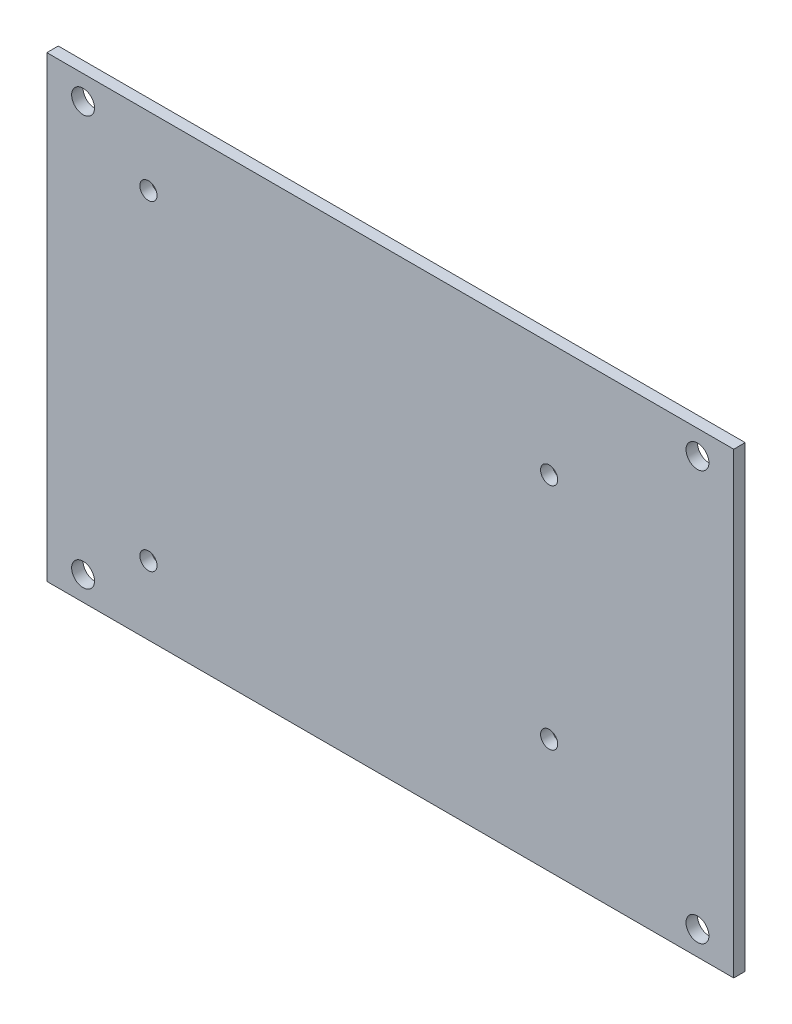
from build123d import *

# Parameters (mm, degrees)
SKETCH1_W           = 120
SKETCH1_H           = 80
SKETCH1_R           = 1.5
SKETCH1_R_2         = 2
BOSS_EXTRUDE3_DEPTH = 2


with BuildPart() as part:
    # Sketch1 → Boss-Extrude3 (new body)
    with BuildSketch(Plane.XY):
        Rectangle(SKETCH1_W, SKETCH1_H)
        with Locations((-42.25, 28)):
            Circle(SKETCH1_R, mode=Mode.SUBTRACT)
        with Locations((27.75, 20)):
            Circle(SKETCH1_R, mode=Mode.SUBTRACT)
        with Locations(Location((27.75, -20, 0), (0, 0, 180))):
            Circle(SKETCH1_R, mode=Mode.SUBTRACT)
        with Locations(Location((-42.25, -28, 0), (0, 0, 180))):
            Circle(SKETCH1_R, mode=Mode.SUBTRACT)
        with Locations((-53.664076267, 35.776050844)):
            Circle(SKETCH1_R_2, mode=Mode.SUBTRACT)
        with Locations(Location((53.664076267, 35.776050844, 0), (0, 0, 180))):
            Circle(SKETCH1_R_2, mode=Mode.SUBTRACT)
        with Locations((53.664076267, -35.776050844)):
            Circle(SKETCH1_R_2, mode=Mode.SUBTRACT)
        with Locations(Location((-53.664076267, -35.776050844, 0), (0, 0, 180))):
            Circle(SKETCH1_R_2, mode=Mode.SUBTRACT)
    extrude(amount=BOSS_EXTRUDE3_DEPTH)


solid = part.part
